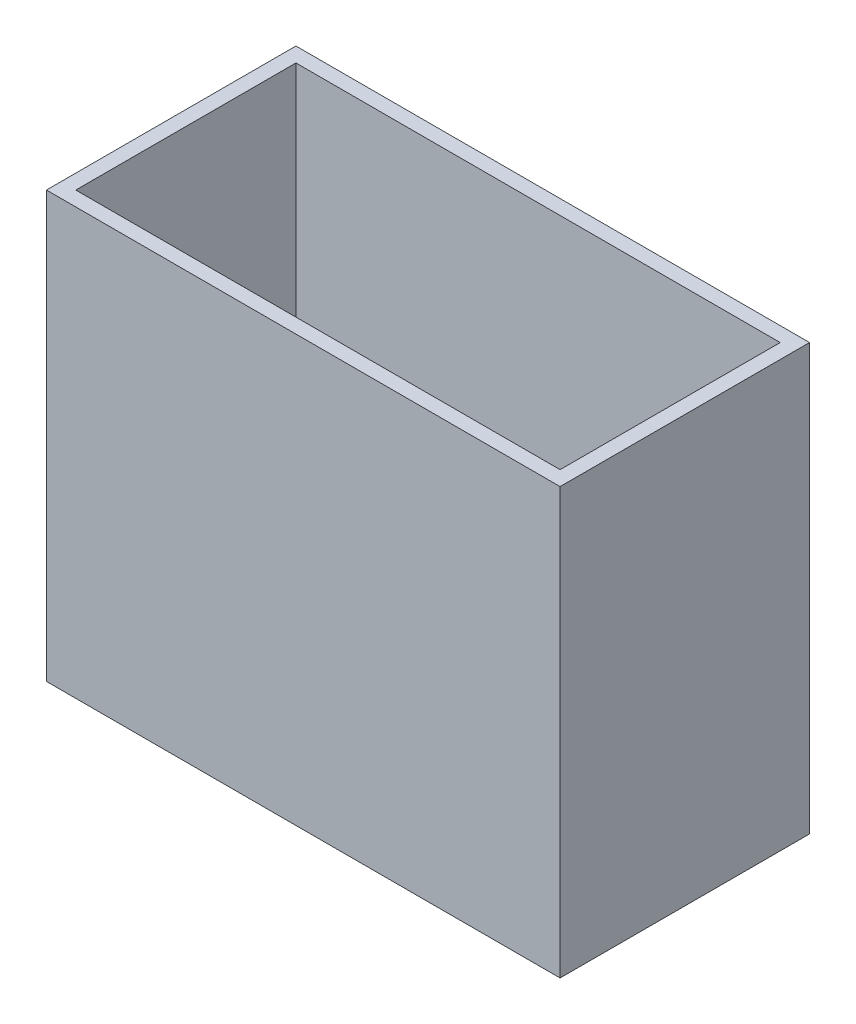
from build123d import *

# Parameters (mm, degrees)
SKETCH1_W           = 70
SKETCH1_H           = 34
BOSS_EXTRUDE2_DEPTH = 58
SKETCH4_W           = 66
SKETCH4_H           = 30
CUT_EXTRUDE1_DEPTH  = 56
SKETCH5_W           = 24
SKETCH5_H           = 20
CUT_EXTRUDE2_DEPTH  = 2


with BuildPart() as part:
    # Sketch1 → Boss-Extrude2 (new body)
    with BuildSketch(Plane(origin=(0, 0, 0), x_dir=(1, 0, 0), z_dir=(0, 1, 0))):
        with Locations((-35, -17)):
            Rectangle(SKETCH1_W, SKETCH1_H)
    extrude(amount=BOSS_EXTRUDE2_DEPTH)

    # Sketch4 → Cut-Extrude1 (cut)
    with BuildSketch(Plane(origin=(0, 58, 0), x_dir=(1, 0, 0), z_dir=(0, 1, 0))):
        with Locations((-35, -17)):
            Rectangle(SKETCH4_W, SKETCH4_H)
    extrude(amount=-CUT_EXTRUDE1_DEPTH, mode=Mode.SUBTRACT)

    # Sketch5 → Cut-Extrude2 (cut)
    with BuildSketch(Plane(origin=(0, 2, 0), x_dir=(1, 0, 0), z_dir=(0, 1, 0))):
        with Locations((-44, -17)):
            Rectangle(SKETCH5_W, SKETCH5_H)
    extrude(amount=-CUT_EXTRUDE2_DEPTH, mode=Mode.SUBTRACT)


solid = part.part
